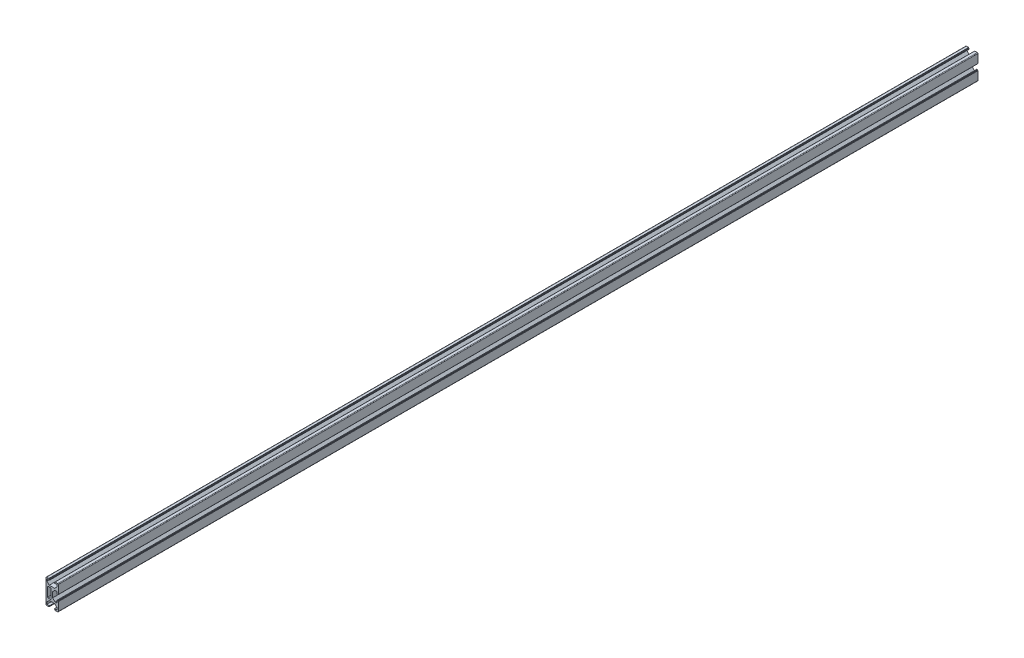
from build123d import *

# Parameters (mm, degrees)
EXTRUDE_3_DEPTH = 1500


with BuildPart() as part:
    # 草图30 → 凸台-拉伸3 (new body)
    with BuildSketch(Plane.XY):
        with BuildLine():
            Line((0.8, 4.385786438), (4.664213562, 8.25))
            Line((4.664213562, 8.25), (8, 8.25))
            Line((8, 8.25), (8, 4.1))
            Line((8, 4.1), (9.2, 4.1))
            Line((9.2, 4.1), (9.2, 5.1))
            Line((9.2, 5.1), (10, 5.1))
            Line((10, 5.1), (10, 19))
            ThreePointArc((10, 19), (9.707106781, 19.707106781), (9, 20))
            Line((9, 20), (4.878384215, 20))
            Line((4.878384215, 20), (4.878384215, 19.2))
            Line((4.878384215, 19.2), (3.878384215, 19.2))
            Line((3.878384215, 19.2), (3.878384215, 18))
            Line((3.878384215, 18), (8.028384215, 18))
            Line((8.028384215, 18), (8.028384215, 14.664213562))
            Line((8.028384215, 14.664213562), (4.164170652, 10.8))
            Line((4.164170652, 10.8), (-4.607402223, 10.8))
            Line((-4.607402223, 10.8), (-8.471615785, 14.664213562))
            Line((-8.471615785, 14.664213562), (-8.471615785, 18))
            Line((-8.471615785, 18), (-4.321615785, 18))
            Line((-4.321615785, 18), (-4.321615785, 19.2))
            Line((-4.321615785, 19.2), (-5.321615785, 19.2))
            Line((-5.321615785, 19.2), (-5.321615785, 20))
            Line((-5.321615785, 20), (-9, 20))
            ThreePointArc((-9, 20), (-9.707106781, 19.707106781), (-10, 19))
            Line((-10, 19), (-10, -19))
            ThreePointArc((-10, -19), (-9.707106781, -19.707106781), (-9, -20))
            Line((-9, -20), (-5.321615785, -20))
            Line((-5.321615785, -20), (-5.321615785, -19.2))
            Line((-5.321615785, -19.2), (-4.321615785, -19.2))
            Line((-4.321615785, -19.2), (-4.321615785, -18))
            Line((-4.321615785, -18), (-8.471615785, -18))
            Line((-8.471615785, -18), (-8.471615785, -14.664213562))
            Line((-8.471615785, -14.664213562), (-4.607402223, -10.8))
            Line((-4.607402223, -10.8), (4.164170652, -10.8))
            Line((4.164170652, -10.8), (8.028384215, -14.664213562))
            Line((8.028384215, -14.664213562), (8.028384215, -18))
            Line((8.028384215, -18), (3.878384215, -18))
            Line((3.878384215, -18), (3.878384215, -19.2))
            Line((3.878384215, -19.2), (4.878384215, -19.2))
            Line((4.878384215, -19.2), (4.878384215, -20))
            Line((4.878384215, -20), (9, -20))
            ThreePointArc((9, -20), (9.707106781, -19.707106781), (10, -19))
            Line((10, -19), (10, -5.1))
            Line((10, -5.1), (9.2, -5.1))
            Line((9.2, -5.1), (9.2, -4.1))
            Line((9.2, -4.1), (8, -4.1))
            Line((8, -4.1), (8, -8.25))
            Line((8, -8.25), (4.664213562, -8.25))
            Line((4.664213562, -8.25), (0.8, -4.385786438))
            Line((0.8, -4.385786438), (0.8, 4.385786438))
        make_face()
        with BuildLine():
            Line((-1.7, 7.3), (-1.7, -7.3))
            ThreePointArc((-1.7, -7.3), (-1.992893219, -8.007106781), (-2.7, -8.3))
            Line((-2.7, -8.3), (-6.5, -8.3))
            ThreePointArc((-6.5, -8.3), (-7.207106781, -8.007106781), (-7.5, -7.3))
            Line((-7.5, -7.3), (-7.5, 7.3))
            ThreePointArc((-7.5, 7.3), (-7.207106781, 8.007106781), (-6.5, 8.3))
            Line((-6.5, 8.3), (-2.7, 8.3))
            ThreePointArc((-2.7, 8.3), (-1.992893219, 8.007106781), (-1.7, 7.3))
        make_face(mode=Mode.SUBTRACT)
    extrude(amount=EXTRUDE_3_DEPTH)


solid = part.part
